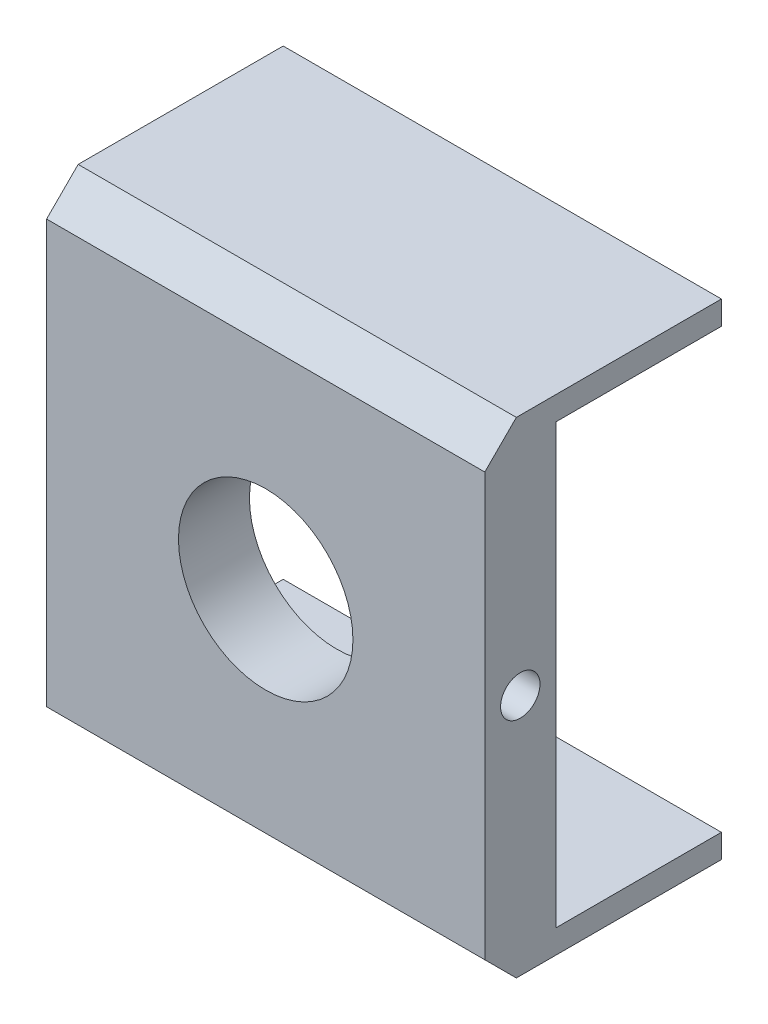
from build123d import *

# Parameters (mm, degrees)
SKETCH1_W      = 35.2806
SKETCH1_H      = 39.0906
EXTRUDE1_DEPTH = 9.525
SKETCH2_R      = 7.0231
EXTRUDE2_DEPTH = 33.497714322
EXTRUDE4_DEPTH = 42.442310667
CHAMFER1_SIZE  = 2.54


with BuildPart() as part:
    # Sketch1 → Extrude1 (new, symmetric)
    with BuildSketch(Plane.XY):
        Rectangle(SKETCH1_W, SKETCH1_H)
    extrude(amount=EXTRUDE1_DEPTH, both=True)

    # Sketch2 → Extrude2 (cut, through all)
    with BuildSketch(Plane.XY.offset(9.525)):
        Circle(SKETCH2_R)
    extrude(amount=-EXTRUDE2_DEPTH, mode=Mode.SUBTRACT)

    # Sketch3 → Extrude4 (cut, through all)
    with BuildSketch(Plane.ZY.offset(17.6403)):
        Polygon((-9.525, 17.6403), (3.81, 17.6403), (3.81, -17.6403), (-9.525, -17.6403), (-9.525, 0), align=None)
    extrude(amount=-EXTRUDE4_DEPTH, mode=Mode.SUBTRACT)

    # Sketch5 → 1/8 (0.125) Diameter Hole1 (revolve, cut)
    with BuildSketch(Plane(origin=(-17.6403, 0, 6.6675), x_dir=(0, 0, 1), z_dir=(0, 1, 0))):
        Polygon((0, 0), (0, 7.303866233), (1.5875, 6.35), (1.5875, 0), align=None)
    f_1_8_0_125_diameter_hole1 = revolve(axis=Axis((-23.9903, 0, 6.6675), (1, 0, 0)), mode=Mode.SUBTRACT)

    # Mirror1: 1/8 (0.125) Diameter Hole1 across plane
    add(f_1_8_0_125_diameter_hole1.mirror(Plane(origin=(0, 0, 0), x_dir=(0, 0, 1), z_dir=(1, 0, 0))), mode=Mode.SUBTRACT)

    # Chamfer1
    chamfer1_edges = [part.edges().sort_by_distance(p)[0] for p in [
        (0, -19.5453, 9.525),
        (0, 19.5453, 9.525),
    ]]
    chamfer(chamfer1_edges, length=CHAMFER1_SIZE)


solid = part.part
